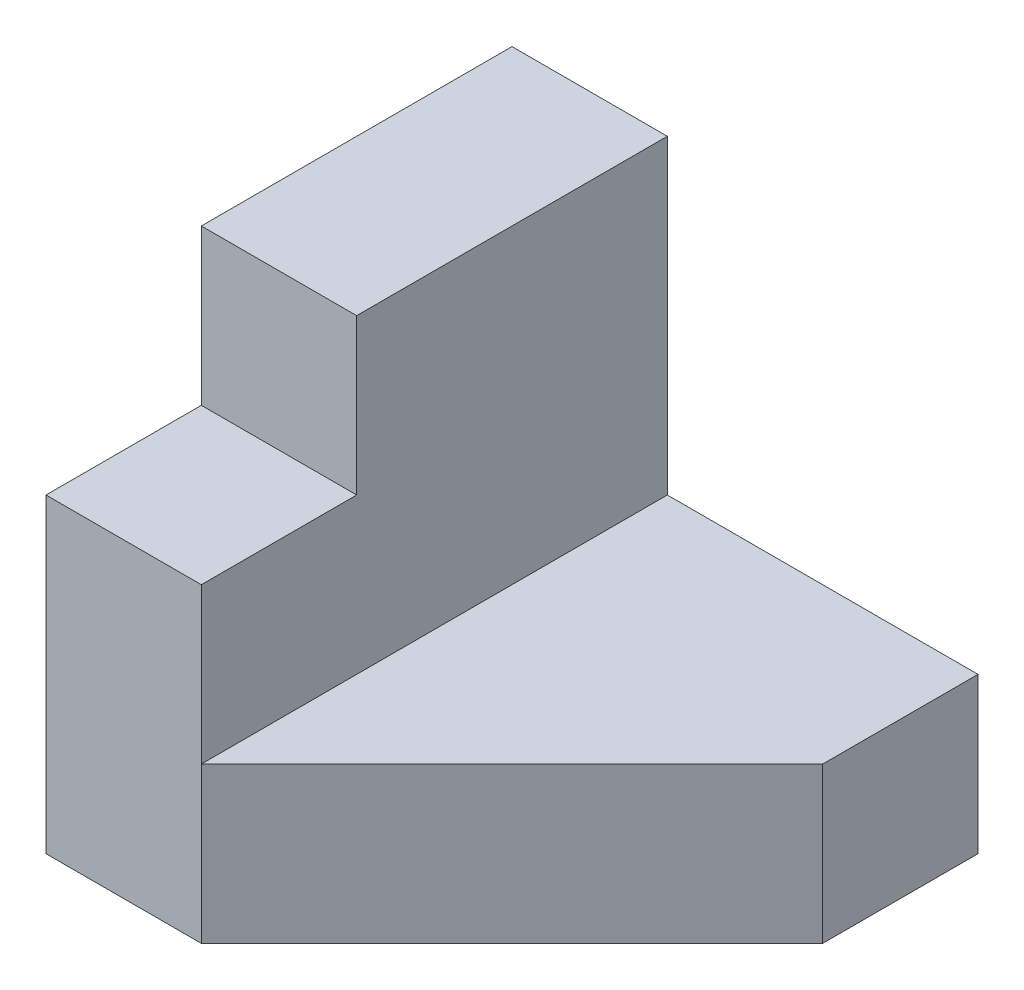
from build123d import *

# Parameters (mm, degrees)
SKETCH_1_W           = 30
SKETCH_1_H           = 30
EXTRUDE_1_DEPTH      = 30
SKETCH_34_W          = 20
SKETCH_34_H          = 20
CUT_EXTRUDE_23_DEPTH = 52.961524227
SKETCH_35_W          = 10
SKETCH_35_H          = 10
CUT_EXTRUDE_24_DEPTH = 47.904157598
CUT_EXTRUDE_25_DEPTH = 47.904157598


with BuildPart() as part:
    # 草圖1 → 填料-伸1 (new body)
    with BuildSketch(Plane.XY):
        with Locations((15, 15)):
            Rectangle(SKETCH_1_W, SKETCH_1_H)
    extrude(amount=-EXTRUDE_1_DEPTH)

    # 草圖34 → 除料-伸長23 (cut, through all)
    with BuildSketch(Plane.XY):
        with Locations((20, 20)):
            Rectangle(SKETCH_34_W, SKETCH_34_H)
    extrude(amount=-CUT_EXTRUDE_23_DEPTH, mode=Mode.SUBTRACT)

    # 草圖35 → 除料-伸長24 (cut, through all)
    with BuildSketch(Plane(origin=(10, 0, 0), x_dir=(0, 0, -1), z_dir=(1, 0, 0))):
        with Locations((5, 25)):
            Rectangle(SKETCH_35_W, SKETCH_35_H)
    extrude(amount=-CUT_EXTRUDE_24_DEPTH, mode=Mode.SUBTRACT)

    # 草圖36 → 除料-伸長25 (cut, through all)
    with BuildSketch(Plane(origin=(0, 10, 0), x_dir=(1, 0, 0), z_dir=(0, 1, 0))):
        Polygon((10, 0), (30, 20), (30, 0), align=None)
    extrude(amount=-CUT_EXTRUDE_25_DEPTH, mode=Mode.SUBTRACT)


solid = part.part
